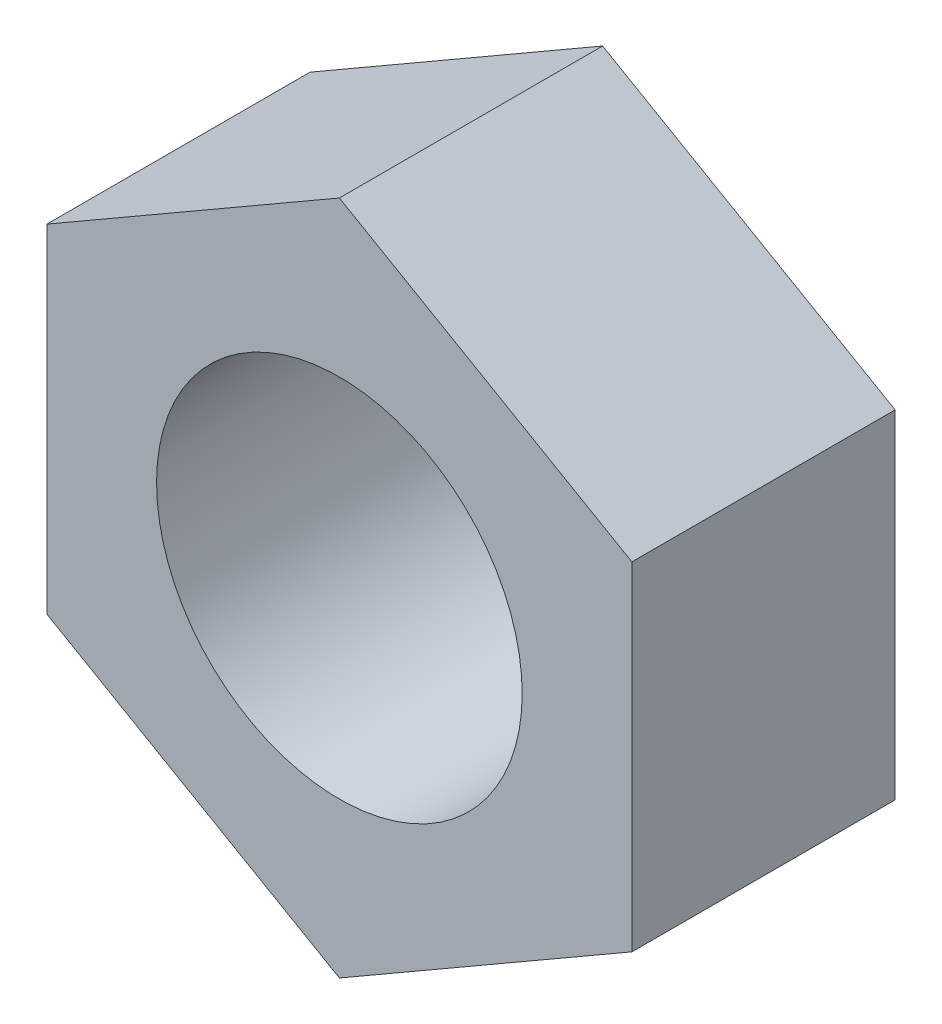
from build123d import *

# Parameters (mm, degrees)
SKETCH_1_R      = 2.5
EXTRUDE_1_DEPTH = 3.6


with BuildPart() as part:
    # Эскиз1 → Вытянуть1 (new body)
    with BuildSketch(Plane.XY):
        Polygon((0, 4.618802154), (-4, 2.309401077), (-4, -2.309401077), (0, -4.618802154), (4, -2.309401077), (4, 2.309401077), align=None)
        with Locations(Location((0, 0, 0), (0, 0, 180))):
            Circle(SKETCH_1_R, mode=Mode.SUBTRACT)
    extrude(amount=EXTRUDE_1_DEPTH)


solid = part.part
